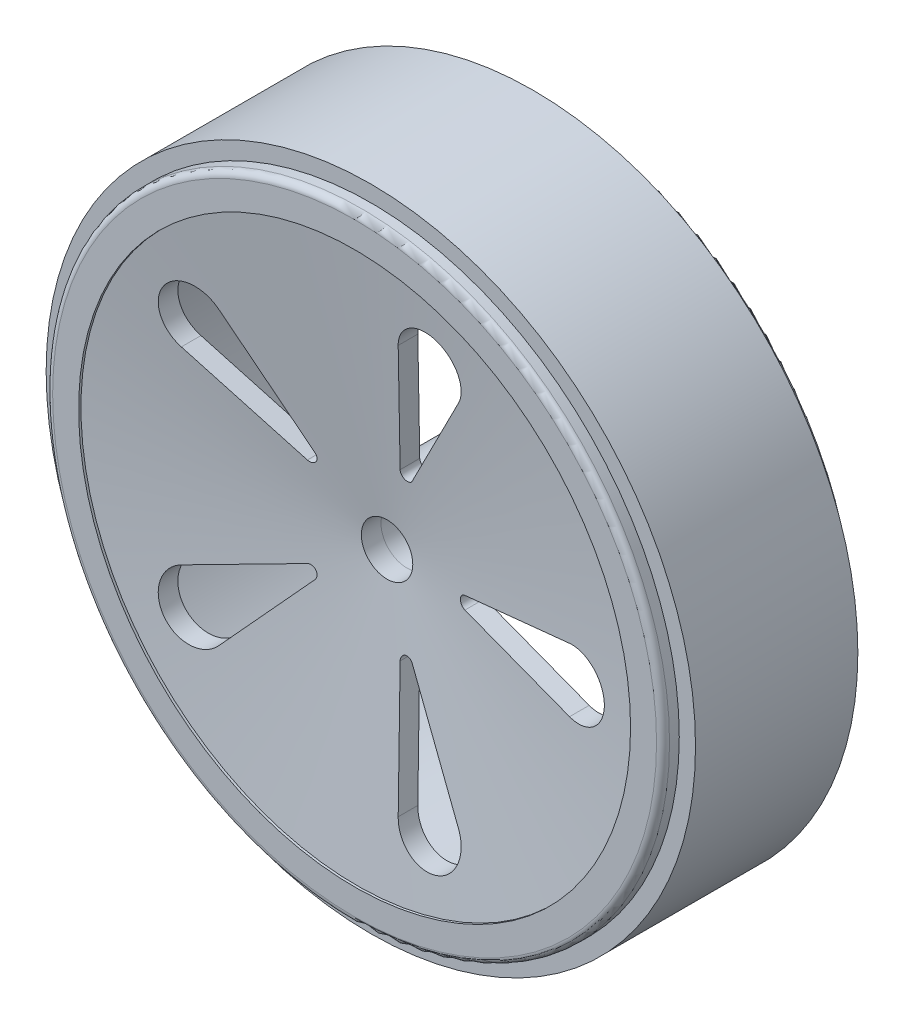
from build123d import *

# Parameters (mm, degrees)
SKETCH1_R                = 47.5
SKETCH1_R_2              = 42.5
BOSS_EXTRUDE1_DEPTH      = 15
BOSS_EXTRUDE2_DEPTH      = 10
BOSS_EXTRUDE2_DEPTH_BACK = 10
SKETCH3_R                = 8
SKETCH3_R_2              = 4
CUT_EXTRUDE1_REACH       = 75.57
CIRPATTERN1_COUNT        = 5
CUT_EXTRUDE2_REACH       = 70.829
CUT_EXTRUDE2_END_RADIUS  = 8
SKETCH6_R                = 1.5
SKETCH8_R                = 50
SKETCH8_R_2              = 47.5
BOSS_EXTRUDE3_DEPTH      = 12.5
FILLET1_R                = 1


with BuildPart() as part:
    # Sketch1 → Boss-Extrude1 (new, symmetric)
    with BuildSketch(Plane.XY):
        Circle(SKETCH1_R)
        Circle(SKETCH1_R_2, mode=Mode.SUBTRACT)
    extrude(amount=BOSS_EXTRUDE1_DEPTH, both=True)



with BuildPart() as body_2:
    # Sketch3 → Boss-Extrude2 (new, two sides: drawn at the far end of the back side and taken through both)
    with BuildSketch(Plane.XY.offset(-BOSS_EXTRUDE2_DEPTH_BACK)):
        Circle(SKETCH3_R)
        Circle(SKETCH3_R_2, mode=Mode.SUBTRACT)
    extrude(amount=BOSS_EXTRUDE2_DEPTH + BOSS_EXTRUDE2_DEPTH_BACK)


with BuildPart() as part_1:
    add(part.part)

    add(body_2.part)  # Revolve1 merges body 2
    # Sketch4 → Revolve1 (revolve)
    with BuildSketch(Plane(origin=(0, 0, 0), x_dir=(1, 0, 0), z_dir=(0, 1, 0))):
        Polygon((3.960243185, -10), (45.481867745, -15), (45.481867745, -11.978327117), (3.960243185, -6.978327117), align=None)
    revolve(axis=Axis((0, 0, -10), (0, 0, 1)))

    # Cut-Extrude1: up to this cone (the profile starts inside it)
    cut_extrude1_end = Plane(origin=(0, 0, 15), z_dir=(0, 0, 1)).offset(-8.498561122) * Cone(8.304e-06, 1288.361062566, 155.143382264, align=(Align.CENTER, Align.CENTER, Align.MIN), mode=Mode.PRIVATE)
    # Sketch5 → Cut-Extrude1 (cut, up to the surface)
    with BuildSketch(Plane.XY.offset(15), mode=Mode.PRIVATE) as cut_extrude1_sk1:
        with BuildLine():
            Line((13.091666667, 0.978057883), (31.458333333, 4.890289414))
            ThreePointArc((31.458333333, 4.890289414), (37.5, 0), (31.458333333, -4.890289414))
            Line((31.458333333, -4.890289414), (13.091666667, -0.978057883))
            ThreePointArc((13.091666667, -0.978057883), (12.3, 0), (13.091666667, 0.978057883))
        make_face()
    cut_extrude1_tool1 = extrude(cut_extrude1_sk1.sketch, amount=-CUT_EXTRUDE1_REACH, mode=Mode.PRIVATE) & cut_extrude1_end
    cut_extrude1 = cut_extrude1_tool1.solids().sort_by_distance((27.284041, 0, 15))[0]
    add(cut_extrude1, mode=Mode.SUBTRACT)

    # CirPattern1: Cut-Extrude1 ×5 about axis
    cirpattern1_axis = Axis((0, 0, 0), (0, 0, 1))
    for i in range(1, CIRPATTERN1_COUNT):
        add(cut_extrude1.rotate(cirpattern1_axis, i * 360 / CIRPATTERN1_COUNT), mode=Mode.SUBTRACT)

    # Cut-Extrude2: up to this cylinder (the profile starts inside it)
    cut_extrude2_end = Plane(origin=(0, 0, 0), z_dir=(0, 0, 1)) * Cylinder(CUT_EXTRUDE2_END_RADIUS, 158.658, mode=Mode.PRIVATE)
    # Sketch6 → Cut-Extrude2 (cut, up to the surface)
    with BuildSketch(Plane(origin=(0, 0, 0), x_dir=(1, 0, 0), z_dir=(0, 1, 0)), mode=Mode.PRIVATE) as cut_extrude2_sk1:
        with Locations(Location((0, 0, 0), (0, 0, 270))):
            Circle(SKETCH6_R)
    cut_extrude2_tool1 = extrude(cut_extrude2_sk1.sketch, amount=-CUT_EXTRUDE2_REACH, mode=Mode.PRIVATE) & cut_extrude2_end
    add(cut_extrude2_tool1.solids().sort_by_distance((0, 0, 0))[0], mode=Mode.SUBTRACT)

    # Sketch8 → Boss-Extrude3 (add, symmetric)
    with BuildSketch(Plane.XY):
        Circle(SKETCH8_R)
        Circle(SKETCH8_R_2, mode=Mode.SUBTRACT)
    extrude(amount=BOSS_EXTRUDE3_DEPTH, both=True)

    # Fillet1
    fillet1_edges = [part_1.edges().sort_by_distance(p)[0] for p in [
        (-47.5, 0, -15),
        (-47.5, 0, 15),
    ]]
    fillet(fillet1_edges, radius=FILLET1_R)


solid = part_1.part
